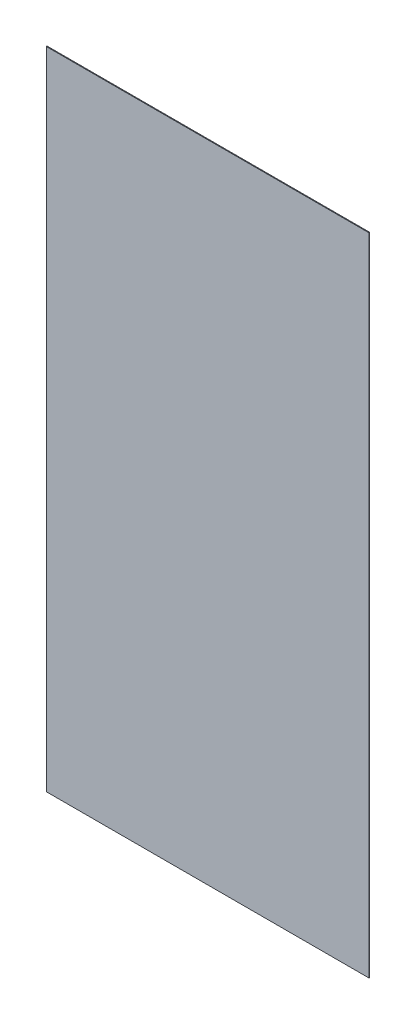
from build123d import *

# Parameters (mm, degrees)
SKETCH1_W           = 1219.2
SKETCH1_H           = 2438.4
BOSS_EXTRUDE1_DEPTH = 2.9972


with BuildPart() as part:
    # Sketch1 → Boss-Extrude1 (new body)
    with BuildSketch(Plane.XY):
        Rectangle(SKETCH1_W, SKETCH1_H)
    extrude(amount=BOSS_EXTRUDE1_DEPTH)


solid = part.part
